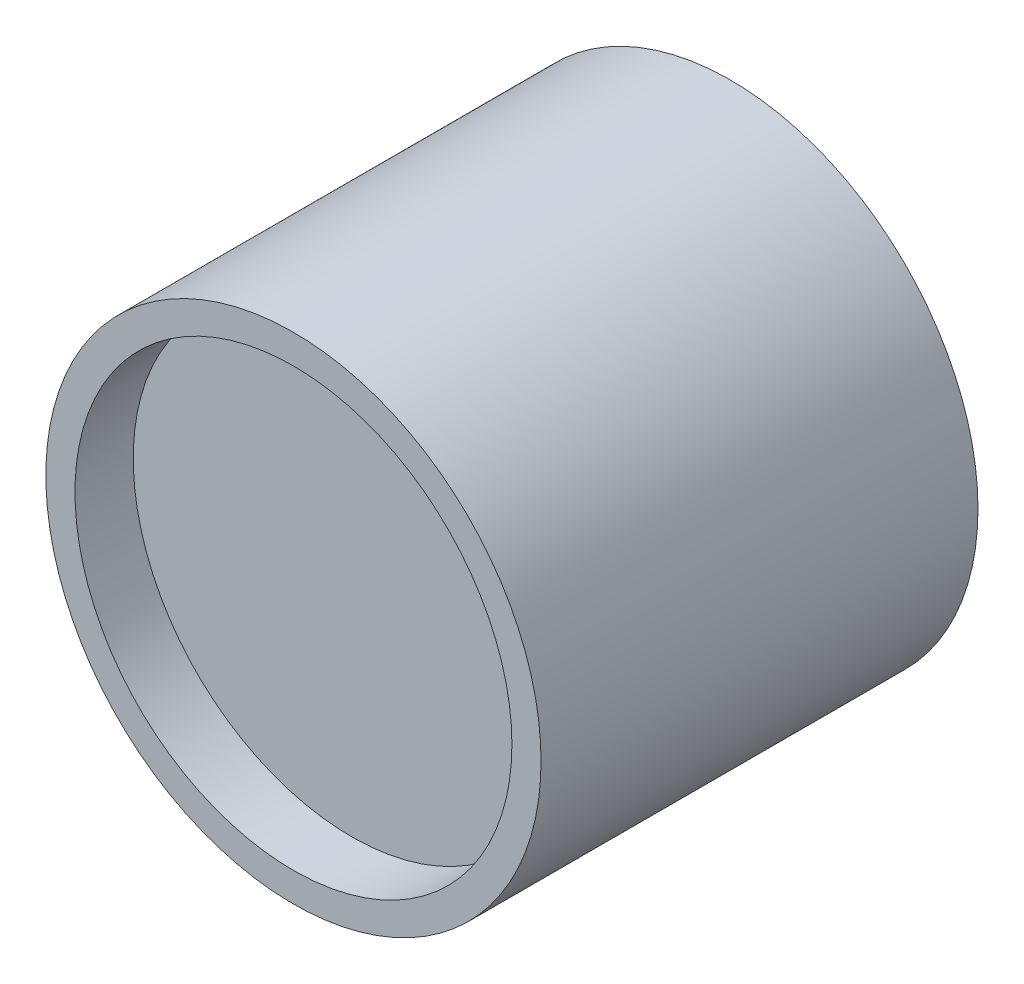
from build123d import *

# Parameters (mm, degrees)
SKETCH1_R           = 42.5
BOSS_EXTRUDE1_DEPTH = 75
SKETCH2_R           = 37.5
CUT_EXTRUDE1_DEPTH  = 10
CUT_EXTRUDE2_START  = -10
SKETCH3_R           = 37.5
CUT_EXTRUDE2_DEPTH  = 10


with BuildPart() as part:
    # Sketch1 → Boss-Extrude1 (new body)
    with BuildSketch(Plane.XY):
        Circle(SKETCH1_R)
    extrude(amount=BOSS_EXTRUDE1_DEPTH)

    # Sketch2 → Cut-Extrude1 (cut)
    with BuildSketch(Plane.XY.offset(75)):
        Circle(SKETCH2_R)
    extrude(amount=-CUT_EXTRUDE1_DEPTH, mode=Mode.SUBTRACT)

    # Sketch3 → Cut-Extrude2 (cut)
    with BuildSketch(Plane(origin=(0, 0, 0), x_dir=(-1, 0, 0), z_dir=(0, 0, -1)).offset(CUT_EXTRUDE2_START)):
        with Locations(Location((0, 0, 0), (0, 0, 180))):
            Circle(SKETCH3_R)
    extrude(amount=CUT_EXTRUDE2_DEPTH, mode=Mode.SUBTRACT)


solid = part.part
